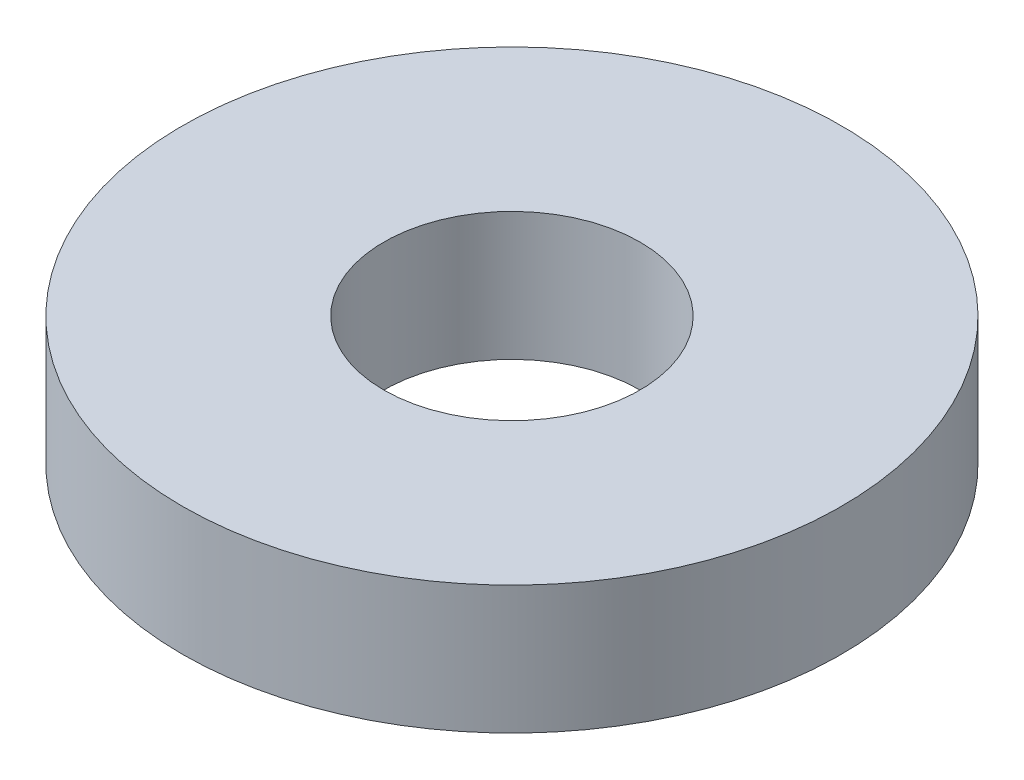
from build123d import *

# Parameters (mm, degrees)
SKETCH_1_R      = 18
SKETCH_1_R_2    = 7
EXTRUDE_1_DEPTH = 7


with BuildPart() as part:
    # Эскиз1 → Вытянуть1 (new body)
    with BuildSketch(Plane(origin=(0, 0, 0), x_dir=(1, 0, 0), z_dir=(0, 1, 0))):
        with Locations(Location((0, 0, 0), (0, 0, 270))):
            Circle(SKETCH_1_R)
        with Locations(Location((0, 0, 0), (0, 0, 270))):
            Circle(SKETCH_1_R_2, mode=Mode.SUBTRACT)
    extrude(amount=EXTRUDE_1_DEPTH)


solid = part.part
